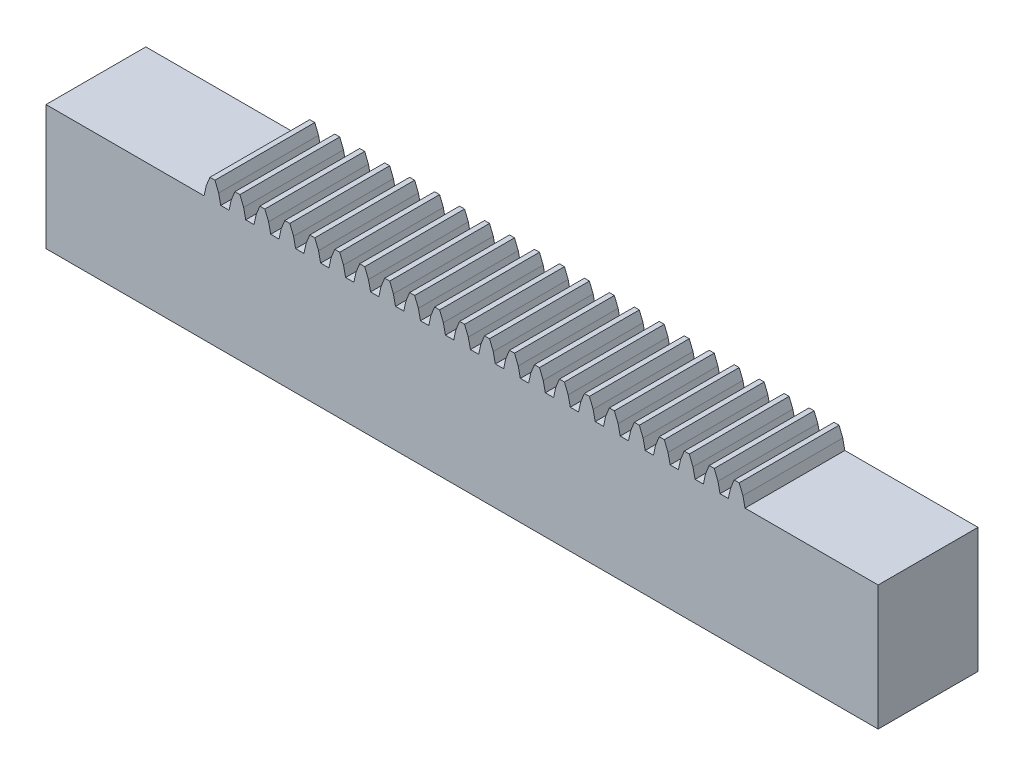
from build123d import *

# Parameters (mm, degrees)
BOSS_EXTRUDE1_DEPTH = 12


with BuildPart() as part:
    # Sketch1 → Boss-Extrude1 (new body)
    with BuildSketch(Plane.XY):
        Polygon((1.001450614, 7.5), (0.749315442, 8.669732015), (0.301638962, 9.779430578), (-0.301638962, 9.779430578), (-0.749315442, 8.669732015), (-1.001450614, 7.5), (-1.998549386, 7.5), (-2.250684558, 8.669732015), (-2.698361038, 9.779430578), (-3.301638962, 9.779430578), (-3.749315442, 8.669732015), (-4.001450614, 7.5), (-4.998549386, 7.5), (-5.250684558, 8.669732015), (-5.698361038, 9.779430578), (-6.301638962, 9.779430578), (-6.749315442, 8.669732015), (-7.001450614, 7.5), (-7.998549386, 7.5), (-8.250684558, 8.669732015), (-8.698361038, 9.779430578), (-9.301638962, 9.779430578), (-9.749315442, 8.669732015), (-10.001450614, 7.5), (-10.998549386, 7.5), (-11.250684558, 8.669732015), (-11.698361038, 9.779430578), (-12.301638962, 9.779430578), (-12.749315442, 8.669732015), (-13.001450614, 7.5), (-13.998549386, 7.5), (-14.250684558, 8.669732015), (-14.698361038, 9.779430578), (-15.301638962, 9.779430578), (-15.749315442, 8.669732015), (-16.001450614, 7.5), (-16.998549386, 7.5), (-17.250684558, 8.669732015), (-17.698361038, 9.779430578), (-18.301638962, 9.779430578), (-18.749315442, 8.669732015), (-19.001450614, 7.5), (-19.998549386, 7.5), (-20.250684558, 8.669732015), (-20.698361038, 9.779430578), (-21.301638962, 9.779430578), (-21.749315442, 8.669732015), (-22.001450614, 7.5), (-22.998549386, 7.5), (-23.250684558, 8.669732015), (-23.698361038, 9.779430578), (-24.301638962, 9.779430578), (-24.749315442, 8.669732015), (-25.001450614, 7.5), (-25.998549386, 7.5), (-26.250684558, 8.669732015), (-26.698361038, 9.779430578), (-27.301638962, 9.779430578), (-27.749315442, 8.669732015), (-28.001450614, 7.5), (-28.998549386, 7.5), (-29.250684558, 8.669732015), (-29.698361038, 9.779430578), (-30.301638962, 9.779430578), (-30.749315442, 8.669732015), (-31.001450614, 7.5), (-50, 7.5), (-50, -7.5), (50, -7.5), (50, 7.5), (34.001450614, 7.5), (33.749315442, 8.669732015), (33.301638962, 9.779430578), (32.698361038, 9.779430578), (32.250684558, 8.669732015), (31.998549386, 7.5), (31.001450614, 7.5), (30.749315442, 8.669732015), (30.301638962, 9.779430578), (29.698361038, 9.779430578), (29.250684558, 8.669732015), (28.998549386, 7.5), (28.001450614, 7.5), (27.749315442, 8.669732015), (27.301638962, 9.779430578), (26.698361038, 9.779430578), (26.250684558, 8.669732015), (25.998549386, 7.5), (25.001450614, 7.5), (24.749315442, 8.669732015), (24.301638962, 9.779430578), (23.698361038, 9.779430578), (23.250684558, 8.669732015), (22.998549386, 7.5), (22.001450614, 7.5), (21.749315442, 8.669732015), (21.301638962, 9.779430578), (20.698361038, 9.779430578), (20.250684558, 8.669732015), (19.998549386, 7.5), (19.001450614, 7.5), (18.749315442, 8.669732015), (18.301638962, 9.779430578), (17.698361038, 9.779430578), (17.250684558, 8.669732015), (16.998549386, 7.5), (16.001450614, 7.5), (15.749315442, 8.669732015), (15.301638962, 9.779430578), (14.698361038, 9.779430578), (14.250684558, 8.669732015), (13.998549386, 7.5), (13.001450614, 7.5), (12.749315442, 8.669732015), (12.301638962, 9.779430578), (11.698361038, 9.779430578), (11.250684558, 8.669732015), (10.998549386, 7.5), (10.001450614, 7.5), (9.749315442, 8.669732015), (9.301638962, 9.779430578), (8.698361038, 9.779430578), (8.250684558, 8.669732015), (7.998549386, 7.5), (7.001450614, 7.5), (6.749315442, 8.669732015), (6.301638962, 9.779430578), (5.698361038, 9.779430578), (5.250684558, 8.669732015), (4.998549386, 7.5), (4.001450614, 7.5), (3.749315442, 8.669732015), (3.301638962, 9.779430578), (2.698361038, 9.779430578), (2.250684558, 8.669732015), (1.998549386, 7.5), align=None)
    extrude(amount=BOSS_EXTRUDE1_DEPTH)


solid = part.part
